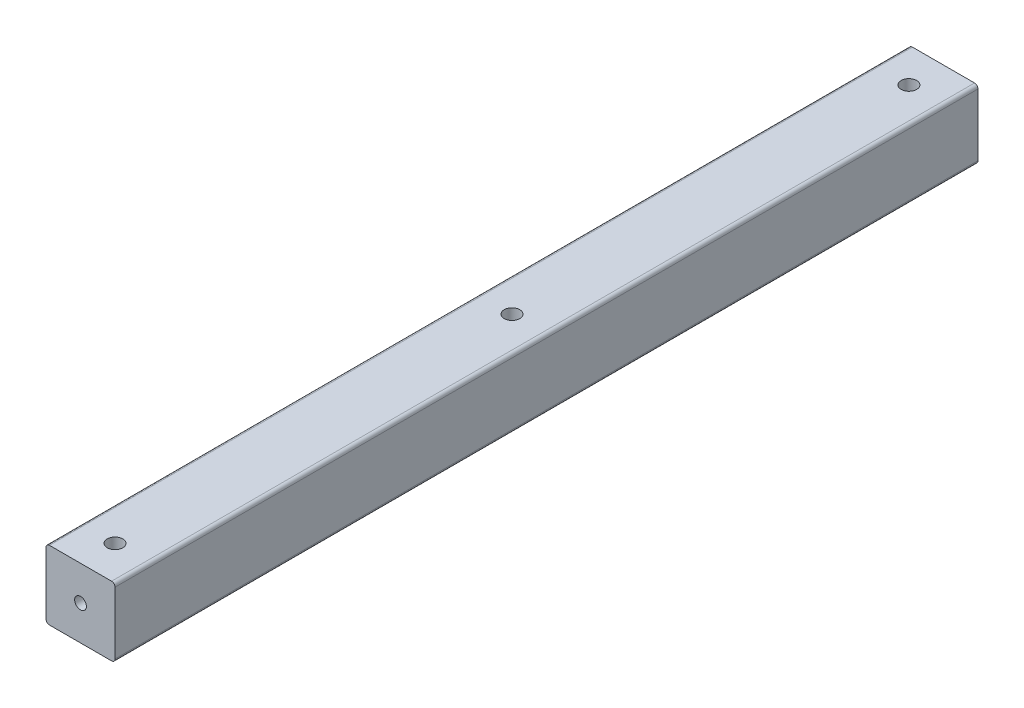
from build123d import *

# Parameters (mm, degrees)
SKETCH1_W                                           = 40
SKETCH1_H                                           = 40
SKETCH1_R                                           = 2.5
BOSS_EXTRUDE1_DEPTH                                 = 250
FILLET1_R                                           = 2
CBORE_FOR_M8_HEX_SOCKET_HEAD_CAP_SCREW1_D           = 9
CBORE_FOR_M8_HEX_SOCKET_HEAD_CAP_SCREW1_CBORE_D     = 15
CBORE_FOR_M8_HEX_SOCKET_HEAD_CAP_SCREW1_CBORE_DEPTH = 8.6


with BuildPart() as part:
    # Sketch1 → Boss-Extrude1 (new, symmetric)
    with BuildSketch(Plane.XY):
        Rectangle(SKETCH1_W, SKETCH1_H)
        Circle(SKETCH1_R, mode=Mode.SUBTRACT)
    extrude(amount=BOSS_EXTRUDE1_DEPTH, both=True)

    # Fillet1
    fillet1_edges = [part.edges().sort_by_distance(p)[0] for p in [
        (20, -20, 0),
        (-20, -20, 0),
        (-20, 20, 0),
        (20, 20, 0),
    ]]
    fillet(fillet1_edges, radius=FILLET1_R)

    # CBORE for M8 Hex Socket Head Cap Screw1 (through all)
    with Locations(Plane(origin=(0, -20, 0), x_dir=(-1, 0, 0), z_dir=(0, -1, 0))):
        with Locations((0, 500), (0, 0), (0, -500), (0, 230), (0, -230)):
            CounterBoreHole(CBORE_FOR_M8_HEX_SOCKET_HEAD_CAP_SCREW1_D / 2, CBORE_FOR_M8_HEX_SOCKET_HEAD_CAP_SCREW1_CBORE_D / 2, CBORE_FOR_M8_HEX_SOCKET_HEAD_CAP_SCREW1_CBORE_DEPTH)

    # Sketch9 → M8x1.25 Tapped Hole1 (revolve, cut)
    with BuildSketch(Plane(origin=(0, 0, 250), x_dir=(0, -1, 0), z_dir=(1, 0, 0))):
        Polygon((0, 0), (0, 29.792926105), (3.4, 27.75), (3.4, 0), align=None)
    m8x1_25_tapped_hole1 = revolve(axis=Axis((0, 0, 256.35), (0, 0, -1)), mode=Mode.SUBTRACT)

    # Mirror1: M8x1.25 Tapped Hole1 across plane
    add(m8x1_25_tapped_hole1.mirror(Plane.XY), mode=Mode.SUBTRACT)


solid = part.part
